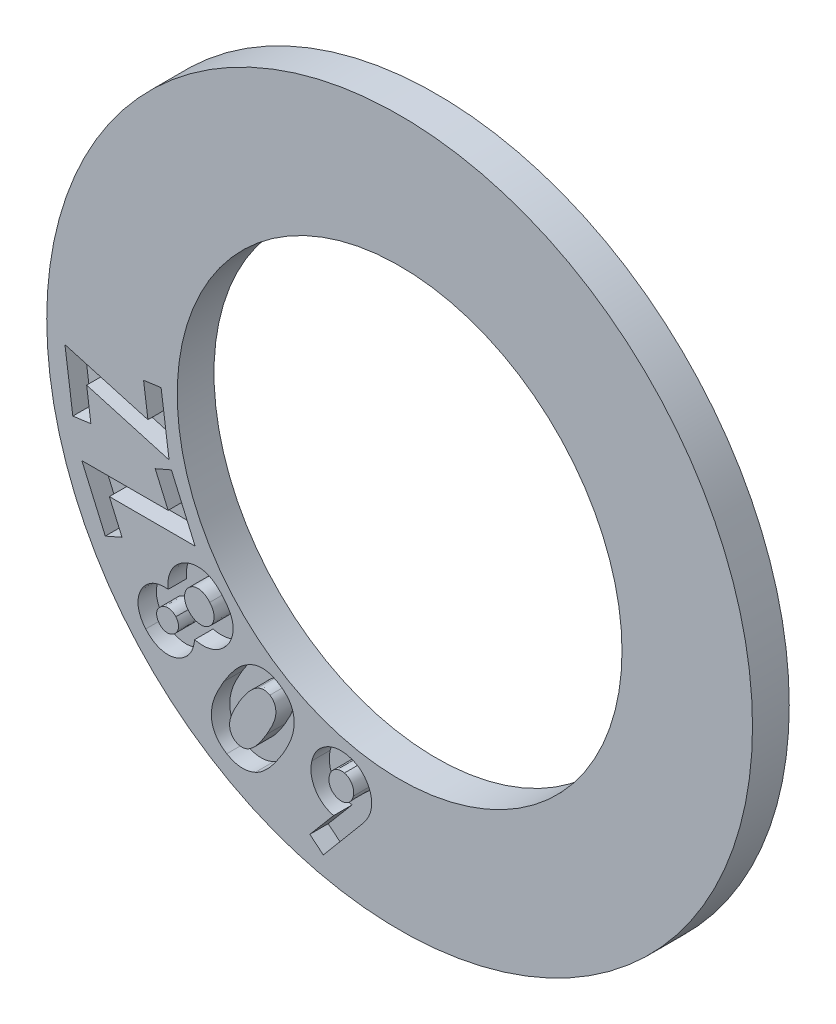
from build123d import *

# Parameters (mm, degrees)
SKETCH1_R           = 9.6
SKETCH1_R_2         = 6.05
BOSS_EXTRUDE1_DEPTH = 1
CUT_EXTRUDE1_DEPTH  = 0.5


with BuildPart() as part:
    # Sketch1 → Boss-Extrude1 (new body)
    with BuildSketch(Plane.XY):
        Circle(SKETCH1_R)
        Circle(SKETCH1_R_2, mode=Mode.SUBTRACT)
    extrude(amount=BOSS_EXTRUDE1_DEPTH)

    # Sketch2 → Cut-Extrude1 (cut)
    # profile 1 of 5: a face of its own
    with BuildSketch(Plane(origin=(0, 0, 1), x_dir=(-1, 0, 0), z_dir=(0, 0, -1))):
        Polygon((8.890156054, -1.935451646), (9.104252132, -0.357834674), (6.847018848, -0.999481884), (6.965203438, -0.129051987), (6.488667132, -0.064249467), (6.271844521, -1.65761186), (8.514239395, -1.017891134), (8.398753682, -1.868717145), align=None)
    # profile 2 of 5: a face of its own
    with BuildSketch(Plane(origin=(0, 0, 1), x_dir=(-1, 0, 0), z_dir=(0, 0, -1))):
        Polygon((8.006176083, -4.320560547), (8.644559969, -2.861239402), (6.297121805, -2.859725528), (6.649059911, -2.054636864), (6.208358864, -1.861621186), (5.563761336, -3.336078487), (7.896306962, -3.334763714), (7.552196812, -4.121778432), align=None)
    # profile 3 of 5: a face of its own
    with BuildSketch(Plane(origin=(0, 0, 1), x_dir=(-1, 0, 0), z_dir=(0, 0, -1))):
        with BuildLine():
            add(Edge.make_bspline(
                [(6.292450839, -4.71685014), (6.296231193, -4.682176947), (6.303695055, -4.613718822), (6.299500805, -4.510870124), (6.282570908, -4.410384792), (6.252624945, -4.313037783), (6.210396449, -4.220791991), (6.157710542, -4.134308751), (6.093891309, -4.054693471), (6.043852901, -4.008205609), (6.018613119, -3.984756751)],
                knots=[0, 0, 0, 0, 1.024853837, 2.023452895, 3.016288006, 4.01514397, 5.010261526, 5.9929112, 6.987607984, 8, 8, 8, 8], degree=3))
            add(Edge.make_bspline(
                [(6.018613119, -3.984756751), (5.989449767, -3.96133002), (5.931785214, -3.915008459), (5.835151695, -3.860987935), (5.732875157, -3.820460949), (5.625912679, -3.793530031), (5.517201798, -3.781285064), (5.409617772, -3.784153092), (5.304570685, -3.801470103), (5.219964587, -3.82967156), (5.153721518, -3.859262004), (5.104035215, -3.886570632), (5.05466803, -3.918917285), (5.004977701, -3.954783044), (4.956144384, -3.995875502), (4.906909349, -4.04052485), (4.857910449, -4.090167931), (4.826505161, -4.125885519), (4.810431036, -4.144166802)],
                knots=[0, 0, 0, 0, 1.305368651, 2.581099024, 3.850764689, 5.140623808, 6.423980154, 7.661476375, 8.890318023, 10.130629344, 10.765814822, 11.424103313, 12.109287923, 12.827286802, 13.564226721, 14.338200307, 15.149443372, 16, 16, 16, 16], degree=3))
            add(Edge.make_bspline(
                [(4.810431036, -4.144166802), (4.793521732, -4.163962083), (4.760541974, -4.202570626), (4.716083255, -4.261783345), (4.675779028, -4.319263734), (4.641071981, -4.375852092), (4.610055429, -4.430730905), (4.584845547, -4.484850577), (4.56469637, -4.537854511), (4.544080728, -4.606284927), (4.529116978, -4.692371852), (4.525897362, -4.796777852), (4.539194226, -4.901863225), (4.567030692, -5.00642441), (4.609410348, -5.108118487), (4.665566501, -5.204663165), (4.736800609, -5.293833946), (4.793074304, -5.346039497), (4.821752819, -5.372644781)],
                knots=[0, 0, 0, 0, 0.896755792, 1.749024705, 2.550016539, 3.314585236, 4.035324707, 4.720755999, 5.369330125, 5.987484303, 7.180911662, 8.36780135, 9.573414341, 10.816984, 12.085144379, 13.357898105, 14.653517282, 16, 16, 16, 16], degree=3))
            add(Edge.make_bspline(
                [(4.821752819, -5.372644781), (4.84827292, -5.394154083), (4.900365273, -5.436403929), (4.986017847, -5.487356661), (5.075309221, -5.526581845), (5.168569237, -5.553712707), (5.265540433, -5.569585114), (5.366499219, -5.573878496), (5.471481355, -5.566483537), (5.541707694, -5.552853565), (5.577644402, -5.545878741)],
                knots=[0, 0, 0, 0, 1.015115964, 1.993950896, 2.955318204, 3.910439945, 4.876497123, 5.872576642, 6.91134021, 8, 8, 8, 8], degree=3))
            add(Edge.make_bspline(
                [(5.577644402, -5.545878741), (5.580484821, -5.57331704), (5.586042257, -5.627001569), (5.602578712, -5.704928), (5.625289884, -5.778455797), (5.653676969, -5.848097739), (5.688567781, -5.913356571), (5.729814822, -5.974219876), (5.777994102, -6.030122423), (5.814206137, -6.063566), (5.832440685, -6.080406493)],
                knots=[0, 0, 0, 0, 1.088464957, 2.129641125, 3.13880773, 4.12337705, 5.094137209, 6.054973659, 7.020583194, 8, 8, 8, 8], degree=3))
            add(Edge.make_bspline(
                [(5.832440685, -6.080406493), (5.858665818, -6.101709414), (5.910224428, -6.143590956), (5.996641344, -6.192165189), (6.087035961, -6.22931833), (6.181811268, -6.252399652), (6.278094963, -6.263746053), (6.374950486, -6.260788022), (6.471110637, -6.24375008), (6.565922949, -6.212761042), (6.658253372, -6.1691234), (6.746534075, -6.111932026), (6.830596994, -6.042033888), (6.880739865, -5.987160124), (6.906414341, -5.959063305)],
                knots=[0, 0, 0, 0, 1.002422803, 1.97076321, 2.933279648, 3.898469767, 4.859911783, 5.806096433, 6.76719438, 7.751974939, 8.761712295, 9.79318899, 10.870054379, 12, 12, 12, 12], degree=3))
            add(Edge.make_bspline(
                [(6.906414341, -5.959063305), (6.930091547, -5.92995382), (6.976201186, -5.873265211), (7.03165128, -5.78095692), (7.073902846, -5.686403705), (7.102885757, -5.589810237), (7.117484265, -5.491987108), (7.118855172, -5.394271522), (7.105995939, -5.296932667), (7.079327362, -5.20165659), (7.040880325, -5.110227547), (6.990961989, -5.025267159), (6.930708481, -4.947258172), (6.88254917, -4.902640549), (6.858279071, -4.8801553)],
                knots=[0, 0, 0, 0, 1.117037858, 2.175350161, 3.197735414, 4.196422681, 5.170679331, 6.135746091, 7.099318227, 8.086013301, 9.075625523, 10.046419393, 11.015484382, 12, 12, 12, 12], degree=3))
            add(Edge.make_bspline(
                [(6.858279071, -4.8801553), (6.840406243, -4.865452673), (6.805097485, -4.836406821), (6.747192554, -4.800652805), (6.68754033, -4.770561757), (6.624039757, -4.746759924), (6.554057879, -4.730157101), (6.475508354, -4.719451316), (6.387142401, -4.715232318), (6.325105968, -4.716292221), (6.292450839, -4.71685014)],
                knots=[0, 0, 0, 0, 0.9170639, 1.811710394, 2.692387335, 3.564321737, 4.494782677, 5.539233306, 6.704686117, 8, 8, 8, 8], degree=3))
        make_face()
        with BuildLine():
            add(Edge.make_bspline(
                [(6.528704439, -5.654884461), (6.514953656, -5.669113344), (6.488277314, -5.696717194), (6.441148505, -5.728765106), (6.38896261, -5.748062241), (6.334115668, -5.757314463), (6.277931544, -5.755603918), (6.223128002, -5.741699743), (6.170374192, -5.716716442), (6.139515683, -5.692163431), (6.123537132, -5.67944987)],
                knots=[0, 0, 0, 0, 1.043190885, 2.023776935, 2.978919233, 3.958573061, 4.944778054, 5.923543227, 6.924809667, 8, 8, 8, 8], degree=3))
            add(Edge.make_bspline(
                [(6.123537132, -5.67944987), (6.108638416, -5.665300977), (6.079666339, -5.637787007), (6.046636074, -5.588359409), (6.024823834, -5.534086591), (6.015305285, -5.476367407), (6.015003434, -5.418131181), (6.027987455, -5.361935246), (6.051225953, -5.308569628), (6.075255605, -5.277765574), (6.087517856, -5.262046367)],
                knots=[0, 0, 0, 0, 1.053140134, 2.04793867, 3.027714218, 4.035678567, 5.037081648, 5.99967612, 6.979241393, 8, 8, 8, 8], degree=3))
            add(Edge.make_bspline(
                [(6.087517856, -5.262046367), (6.101510342, -5.247338222), (6.128829254, -5.218622056), (6.177937638, -5.186368361), (6.231546554, -5.165790901), (6.288266006, -5.157064195), (6.345984758, -5.159584898), (6.402728349, -5.174663066), (6.457698751, -5.201012922), (6.490243559, -5.226862284), (6.507015182, -5.24018348)],
                knots=[0, 0, 0, 0, 1.031988442, 2.014852999, 2.965050342, 3.937467417, 4.919217919, 5.887457926, 6.911323764, 8, 8, 8, 8], degree=3))
            add(Edge.make_bspline(
                [(6.507015182, -5.24018348), (6.521703742, -5.25418743), (6.550265559, -5.281418026), (6.582549218, -5.329906797), (6.60285203, -5.38265022), (6.612371975, -5.438223329), (6.609211442, -5.495220895), (6.594682857, -5.55145763), (6.567502624, -5.605709232), (6.541960422, -5.638083005), (6.528704439, -5.654884461)],
                knots=[0, 0, 0, 0, 1.041899463, 2.025967194, 2.967555479, 3.931260986, 4.904606775, 5.882145574, 6.900868324, 8, 8, 8, 8], degree=3))
        make_face(mode=Mode.SUBTRACT)
        with BuildLine():
            add(Edge.make_bspline(
                [(5.740044344, -4.948573334), (5.720070805, -4.969954484), (5.681227048, -5.01153571), (5.611768457, -5.059093508), (5.536951685, -5.09230451), (5.470711432, -5.106783356), (5.417253435, -5.110951474), (5.37824682, -5.111242186), (5.340744562, -5.106725334), (5.304771761, -5.099591733), (5.270426688, -5.087597677), (5.237734159, -5.072230809), (5.206484037, -5.052906165), (5.187396206, -5.03747111), (5.177673068, -5.029608658)],
                knots=[0, 0, 0, 0, 1.66515302, 3.238324511, 4.764125594, 6.31023234, 7.077911842, 7.822004061, 8.530999363, 9.229383497, 9.910087882, 10.600572151, 11.287146386, 12, 12, 12, 12], degree=3))
            add(Edge.make_bspline(
                [(5.177673068, -5.029608658), (5.167946182, -5.020854263), (5.148705975, -5.003537687), (5.123507828, -4.974562572), (5.102428651, -4.94350241), (5.083766112, -4.911357201), (5.069815746, -4.876784002), (5.059043936, -4.840702968), (5.051909497, -4.802982521), (5.048367479, -4.764058805), (5.048153995, -4.724514282), (5.052776713, -4.685142855), (5.060872626, -4.646134239), (5.073567926, -4.607634822), (5.090685024, -4.569775206), (5.11136589, -4.532373576), (5.136347733, -4.495616779), (5.155441251, -4.472297757), (5.16526343, -4.460301873)],
                knots=[0, 0, 0, 0, 0.984890082, 1.948155553, 2.882314859, 3.808863779, 4.741411075, 5.682178967, 6.640931769, 7.626899608, 8.622248044, 9.612961953, 10.606441355, 11.617930914, 12.658745083, 13.731137954, 14.832841024, 16, 16, 16, 16], degree=3))
            add(Edge.make_bspline(
                [(5.16526343, -4.460301873), (5.186008103, -4.4379681), (5.225880297, -4.395041585), (5.294998532, -4.345183994), (5.367568788, -4.310934135), (5.43065478, -4.296395612), (5.480923804, -4.292160189), (5.517871217, -4.294148538), (5.554170098, -4.298486238), (5.589266671, -4.308241531), (5.623798272, -4.320627974), (5.656661719, -4.338129604), (5.689259332, -4.358599804), (5.709373765, -4.375148464), (5.719711028, -4.383653197)],
                knots=[0, 0, 0, 0, 1.740634603, 3.345577987, 4.842409113, 6.303033479, 7.022492209, 7.722297156, 8.41653172, 9.109366691, 9.801537708, 10.511273576, 11.234909684, 12, 12, 12, 12], degree=3))
            add(Edge.make_bspline(
                [(5.719711028, -4.383653197), (5.729681879, -4.39251888), (5.749334636, -4.409993329), (5.774448754, -4.439862631), (5.796355416, -4.471011779), (5.814827057, -4.503747205), (5.82894589, -4.538405481), (5.839763209, -4.574674413), (5.846844683, -4.612744006), (5.850773242, -4.652225956), (5.849925937, -4.692065526), (5.846568376, -4.731565139), (5.837700947, -4.769884361), (5.82653983, -4.80781393), (5.810145714, -4.844353696), (5.790599185, -4.880235962), (5.767501488, -4.91543114), (5.74930062, -4.93740053), (5.740044344, -4.948573334)],
                knots=[0, 0, 0, 0, 1.013199327, 1.997037395, 2.95814882, 3.906124139, 4.8476064, 5.797388022, 6.778747326, 7.787574587, 8.807783302, 9.804646872, 10.795064647, 11.792380577, 12.806113963, 13.832317734, 14.897598492, 16, 16, 16, 16], degree=3))
        make_face(mode=Mode.SUBTRACT)
    # profile 4 of 5: a face of its own
    with BuildSketch(Plane(origin=(0, 0, 1), x_dir=(-1, 0, 0), z_dir=(0, 0, -1))):
        with BuildLine():
            add(Edge.make_bspline(
                [(4.700728427, -7.795616742), (4.720638572, -7.783132272), (4.759771347, -7.758594433), (4.814470153, -7.717412313), (4.864783206, -7.674033873), (4.911525287, -7.628615178), (4.953089061, -7.580121214), (4.990332788, -7.529021594), (5.023192318, -7.475643947), (5.052307077, -7.420027909), (5.075721636, -7.361605919), (5.09438204, -7.300769393), (5.108837783, -7.237649153), (5.117037831, -7.171861113), (5.122292406, -7.103935486), (5.120061159, -7.03350088), (5.115322827, -6.960556113), (5.104257609, -6.884763911), (5.087761363, -6.805773677), (5.064315426, -6.722859126), (5.033804865, -6.635967285), (4.997996979, -6.544058453), (4.953618583, -6.448781817), (4.904050752, -6.348644833), (4.847445386, -6.244464118), (4.80596073, -6.174526152), (4.784625576, -6.138557739)],
                knots=[0, 0, 0, 0, 0.898244672, 1.765472124, 2.614727858, 3.437232938, 4.254952735, 5.053616086, 5.852565071, 6.649712848, 7.450943246, 8.255158175, 9.081068285, 9.923120061, 10.788029142, 11.682991033, 12.614578547, 13.582065778, 14.608729996, 15.698190307, 16.873875029, 18.129006478, 19.468011642, 20.890949559, 22.401045719, 24, 24, 24, 24], degree=3))
            add(Edge.make_bspline(
                [(4.784625576, -6.138557739), (4.762727322, -6.102465829), (4.720119225, -6.032240707), (4.652841848, -5.933253224), (4.587662436, -5.841265745), (4.522388818, -5.7580152), (4.458981279, -5.681672652), (4.394778634, -5.61469299), (4.332245522, -5.554650767), (4.269546607, -5.502929045), (4.207279173, -5.45808791), (4.145461656, -5.419001916), (4.084621454, -5.384417752), (4.02329979, -5.356953344), (3.963161648, -5.332807942), (3.902752166, -5.315711695), (3.842918751, -5.303161926), (3.783299336, -5.296359015), (3.723512487, -5.295196556), (3.66339586, -5.298833071), (3.602630182, -5.307685857), (3.541575369, -5.322483631), (3.480026857, -5.342273676), (3.418196877, -5.367631761), (3.355317386, -5.397304502), (3.31447702, -5.421146208), (3.293602704, -5.433332174)],
                knots=[0, 0, 0, 0, 1.621896698, 3.155773551, 4.59789298, 5.953069552, 7.220030192, 8.409367974, 9.516274512, 10.549465595, 11.529711948, 12.462769859, 13.359122053, 14.215829103, 15.04275324, 15.846931649, 16.624656061, 17.389894974, 18.1489052, 18.919665042, 19.701791843, 20.50519619, 21.330921178, 22.183638005, 23.071621582, 24, 24, 24, 24], degree=3))
            add(Edge.make_bspline(
                [(3.293602704, -5.433332174), (3.27314021, -5.446130931), (3.233042204, -5.471211191), (3.176956879, -5.512848598), (3.125200633, -5.556071252), (3.078120873, -5.601703467), (3.036034509, -5.649641441), (2.998676876, -5.699670076), (2.966410245, -5.752013109), (2.938189331, -5.806269788), (2.914892485, -5.86296653), (2.8964833, -5.922169481), (2.882544486, -5.983605113), (2.873667331, -6.047736577), (2.869269786, -6.114019568), (2.86899656, -6.182799587), (2.874568071, -6.253723252), (2.88362701, -6.327664531), (2.898922501, -6.404987596), (2.921299366, -6.48625663), (2.949718077, -6.57216816), (2.985898136, -6.662414117), (3.02857333, -6.757326057), (3.078491547, -6.856553019), (3.134315936, -6.960696163), (3.17581114, -7.030463309), (3.197190336, -7.066408801)],
                knots=[0, 0, 0, 0, 0.933511523, 1.829295625, 2.700084285, 3.540981242, 4.363336638, 5.16576242, 5.95376278, 6.739893059, 7.529581581, 8.321957783, 9.136118686, 9.964249438, 10.824184875, 11.70479156, 12.62283328, 13.574831975, 14.585816176, 15.669219298, 16.834352981, 18.085147476, 19.429288662, 20.859624376, 22.382012829, 24, 24, 24, 24], degree=3))
            add(Edge.make_bspline(
                [(3.197190336, -7.066408801), (3.227521409, -7.115790646), (3.286145503, -7.211236197), (3.379508936, -7.343863115), (3.470734731, -7.463449574), (3.561917821, -7.568707565), (3.653489188, -7.658961496), (3.743760065, -7.736187022), (3.833981775, -7.799437674), (3.896876706, -7.831198338), (3.927187721, -7.846504786)],
                knots=[0, 0, 0, 0, 1.284191142, 2.482092967, 3.59302117, 4.616925941, 5.565842968, 6.439934982, 7.248156337, 8, 8, 8, 8], degree=3))
            add(Edge.make_bspline(
                [(3.927187721, -7.846504786), (3.959833229, -7.859853273), (4.023763131, -7.885993697), (4.122705669, -7.911422322), (4.220859884, -7.924245793), (4.318567478, -7.924223873), (4.41578037, -7.911548326), (4.512304869, -7.885748904), (4.608378293, -7.847490073), (4.66942776, -7.813198415), (4.700728427, -7.795616742)],
                knots=[0, 0, 0, 0, 1.04588366, 2.048160541, 3.022178198, 3.976877382, 4.940035928, 5.92349365, 6.9353546, 8, 8, 8, 8], degree=3))
        make_face()
        with BuildLine():
            add(Edge.make_bspline(
                [(4.466967208, -7.38342652), (4.448890208, -7.393193098), (4.413183596, -7.41248454), (4.354772228, -7.42928388), (4.294401622, -7.43614614), (4.242906327, -7.432170968), (4.200914994, -7.423650291), (4.168345129, -7.412987653), (4.135148967, -7.39833475), (4.101373041, -7.379895981), (4.067312802, -7.357305604), (4.032006124, -7.331819656), (3.996838211, -7.301367811), (3.960091155, -7.26769048), (3.922421853, -7.228999048), (3.883779817, -7.184542264), (3.843816188, -7.134075909), (3.800707034, -7.079226192), (3.758352063, -7.016807493), (3.712629697, -6.950106555), (3.665769298, -6.877211239), (3.634851609, -6.82624606), (3.618869002, -6.799900092)],
                knots=[0, 0, 0, 0, 1.073362255, 2.120159813, 3.159407462, 4.240635611, 4.808695944, 5.400373974, 6.031191226, 6.706632187, 7.412741198, 8.170311917, 8.985148812, 9.846903314, 10.780229985, 11.811125479, 12.929975119, 14.151240884, 15.462935153, 16.878452578, 18.386345578, 20, 20, 20, 20], degree=3))
            add(Edge.make_bspline(
                [(3.618869002, -6.799900092), (3.598573185, -6.765708357), (3.559566788, -6.699995487), (3.507591618, -6.602993389), (3.46363256, -6.512424232), (3.427957509, -6.42800269), (3.399874383, -6.350205195), (3.380355568, -6.278333427), (3.3679065, -6.212858126), (3.364985536, -6.152819332), (3.368657975, -6.098327532), (3.375734578, -6.047982592), (3.389486908, -6.00192671), (3.407247096, -5.959376387), (3.430784175, -5.920998119), (3.458643459, -5.885923435), (3.492280681, -5.855480725), (3.517703807, -5.838826579), (3.530539313, -5.830418313)],
                knots=[0, 0, 0, 0, 1.764642303, 3.3914544, 4.882955366, 6.231380764, 7.457798339, 8.550814255, 9.53429446, 10.409776827, 11.209959597, 11.956390011, 12.660733017, 13.33733554, 13.997190612, 14.652322853, 15.319591218, 16, 16, 16, 16], degree=3))
            add(Edge.make_bspline(
                [(3.530539313, -5.830418313), (3.543548509, -5.823214546), (3.568936617, -5.809156027), (3.609574553, -5.794761023), (3.650929524, -5.78626144), (3.693389203, -5.783895463), (3.736837693, -5.787611347), (3.781277725, -5.797199757), (3.826368534, -5.813319021), (3.855617051, -5.827961566), (3.870647544, -5.835486209)],
                knots=[0, 0, 0, 0, 0.997599185, 1.946865736, 2.882982674, 3.825398451, 4.793181853, 5.803966976, 6.871482658, 8, 8, 8, 8], degree=3))
            add(Edge.make_bspline(
                [(3.870647544, -5.835486209), (3.889815553, -5.846599485), (3.929966672, -5.869878402), (3.987107768, -5.915746086), (4.045971796, -5.970328754), (4.106245405, -6.034814404), (4.167607751, -6.109454037), (4.229946795, -6.194302238), (4.294110642, -6.288510748), (4.335451915, -6.355680363), (4.3568648, -6.390471147)],
                knots=[0, 0, 0, 0, 0.712445167, 1.492354806, 2.35190915, 3.296258774, 4.33146101, 5.46101176, 6.684920395, 8, 8, 8, 8], degree=3))
            add(Edge.make_bspline(
                [(4.3568648, -6.390471147), (4.377758813, -6.426067567), (4.41787646, -6.494414639), (4.472748121, -6.594397123), (4.51870216, -6.688059858), (4.556327766, -6.775135046), (4.586489077, -6.855404608), (4.607435764, -6.929333618), (4.620966111, -6.99659022), (4.625675287, -7.05784245), (4.623554444, -7.113625699), (4.615867183, -7.164726941), (4.604216218, -7.211910835), (4.586282903, -7.254523246), (4.564338567, -7.293381221), (4.536852037, -7.327896894), (4.504611824, -7.358745865), (4.479610929, -7.375137013), (4.466967208, -7.38342652)],
                knots=[0, 0, 0, 0, 1.792089233, 3.440909255, 4.9506621, 6.31996594, 7.558372941, 8.670644588, 9.652991284, 10.531963663, 11.331388748, 12.071336497, 12.772788479, 13.435328746, 14.072424132, 14.704326223, 15.344737917, 16, 16, 16, 16], degree=3))
        make_face(mode=Mode.SUBTRACT)
    # profile 5 of 5: a face of its own
    with BuildSketch(Plane(origin=(0, 0, 1), x_dir=(-1, 0, 0), z_dir=(0, 0, -1))):
        with BuildLine():
            Line((2.075975898, -8.867229502), (2.442037742, -8.564737894))
            Line((2.442037742, -8.564737894), (1.794478505, -7.798544074))
            add(Edge.make_bspline(
                [(1.794478505, -7.798544074), (1.820964617, -7.79179497), (1.873067153, -7.778518373), (1.947212391, -7.748786528), (2.017197131, -7.7137812), (2.08270224, -7.671966929), (2.142674771, -7.62271753), (2.19866903, -7.56776453), (2.248980162, -7.505552249), (2.294830283, -7.438128539), (2.334168318, -7.366324115), (2.365758356, -7.291692022), (2.389809342, -7.215368145), (2.405504367, -7.137094957), (2.413214049, -7.056855229), (2.412408568, -6.974657237), (2.404990885, -6.890498257), (2.393160628, -6.834639339), (2.387161775, -6.806314557)],
                knots=[0, 0, 0, 0, 1.017149872, 2.000900977, 2.968404557, 3.929192477, 4.888604541, 5.85424859, 6.84661301, 7.86369901, 8.888083039, 9.891018333, 10.87795613, 11.863840162, 12.85934195, 13.874829846, 14.922374753, 16, 16, 16, 16], degree=3))
            add(Edge.make_bspline(
                [(2.387161775, -6.806314557), (2.380192006, -6.77914442), (2.366473564, -6.725666041), (2.337273296, -6.64899094), (2.301124513, -6.577312958), (2.258432192, -6.510669761), (2.209874211, -6.448476891), (2.154059485, -6.39152331), (2.091415237, -6.339736705), (2.023339261, -6.292889797), (1.951339053, -6.252916884), (1.877201322, -6.220071063), (1.801586439, -6.195074715), (1.724551245, -6.178663361), (1.646197361, -6.169540412), (1.5665705, -6.169113773), (1.485435115, -6.175734798), (1.431760629, -6.186797037), (1.404618601, -6.192390972)],
                knots=[0, 0, 0, 0, 1.043482651, 2.053863824, 3.046975941, 4.026671748, 4.995357891, 5.979018667, 6.98862908, 8.016409947, 9.05081794, 10.049466992, 11.030750709, 12.009563231, 12.976461881, 13.961704177, 14.969277807, 16, 16, 16, 16], degree=3))
            add(Edge.make_bspline(
                [(1.404618601, -6.192390972), (1.376563169, -6.199545719), (1.321334913, -6.213630128), (1.242449318, -6.24407306), (1.168944519, -6.28119918), (1.100273379, -6.324280596), (1.037967382, -6.375338619), (0.980587411, -6.432265549), (0.928156195, -6.495785396), (0.882718775, -6.565757455), (0.842689307, -6.63876944), (0.810778608, -6.713525595), (0.785926014, -6.78855468), (0.768880184, -6.864270238), (0.760180961, -6.940639218), (0.759052812, -7.01745304), (0.76503761, -7.094798126), (0.775497423, -7.145800118), (0.780772208, -7.171519941)],
                knots=[0, 0, 0, 0, 1.076771462, 2.119668351, 3.138855414, 4.137930249, 5.129948999, 6.130040132, 7.14214048, 8.188554738, 9.230311112, 10.237272993, 11.209039839, 12.16808984, 13.120150363, 14.064025428, 15.023706265, 16, 16, 16, 16], degree=3))
            add(Edge.make_bspline(
                [(0.780772208, -7.171519941), (0.785695075, -7.191266775), (0.795566926, -7.230865209), (0.816684362, -7.288885259), (0.841553823, -7.346284436), (0.866665251, -7.393732867), (0.890667918, -7.432879936), (0.911992965, -7.465983752), (0.937591986, -7.502234227), (0.966962321, -7.54172392), (0.999782204, -7.584942106), (1.036636897, -7.631227095), (1.077395048, -7.680940574), (1.106233971, -7.71491697), (1.121207521, -7.732557964)],
                knots=[0, 0, 0, 0, 1.104048863, 2.213955231, 3.346623497, 4.498096029, 5.124114234, 5.839024271, 6.635248401, 7.532490536, 8.510510828, 9.580890686, 10.743966451, 12, 12, 12, 12], degree=3))
            Line((1.121207521, -7.732557964), (2.075975898, -8.867229502))
        make_face()
        with BuildLine():
            add(Edge.make_bspline(
                [(1.659476858, -7.344258013), (1.637398016, -7.348178216), (1.594123199, -7.355861864), (1.528587008, -7.350615517), (1.465854129, -7.332444684), (1.40766774, -7.300415508), (1.355426899, -7.257773565), (1.312424441, -7.204802184), (1.278869212, -7.143153769), (1.266287616, -7.097452272), (1.259823616, -7.073972381)],
                knots=[0, 0, 0, 0, 0.996814877, 1.953770138, 2.902120449, 3.890583161, 4.89561901, 5.891498935, 6.916723156, 8, 8, 8, 8], degree=3))
            add(Edge.make_bspline(
                [(1.259823616, -7.073972381), (1.255616103, -7.049928845), (1.247421663, -7.003102287), (1.250195961, -6.932155229), (1.267606693, -6.864588265), (1.297889604, -6.802066786), (1.336866966, -6.746324165), (1.384713086, -6.7010004), (1.43999171, -6.667469749), (1.480865077, -6.655442176), (1.50143053, -6.649390497)],
                knots=[0, 0, 0, 0, 1.079698362, 2.102792092, 3.119512468, 4.150487749, 5.166695323, 6.117818656, 7.052979628, 8, 8, 8, 8], degree=3))
            add(Edge.make_bspline(
                [(1.50143053, -6.649390497), (1.523510207, -6.645451061), (1.567025374, -6.637687126), (1.633434453, -6.643375638), (1.697704716, -6.661954015), (1.758536441, -6.69327309), (1.813280003, -6.735883842), (1.85784641, -6.789675388), (1.892551949, -6.852425754), (1.905529723, -6.899127896), (1.912191673, -6.923101756)],
                knots=[0, 0, 0, 0, 0.976201659, 1.923922042, 2.88018245, 3.883464177, 4.89481687, 5.88873447, 6.916212802, 8, 8, 8, 8], degree=3))
            add(Edge.make_bspline(
                [(1.912191673, -6.923101756), (1.916661267, -6.947069107), (1.925347059, -6.993645032), (1.921650589, -7.063815135), (1.906139154, -7.130626411), (1.87604538, -7.192032803), (1.836005101, -7.246841219), (1.785370097, -7.29107821), (1.726297756, -7.325370563), (1.682203464, -7.33783416), (1.659476858, -7.344258013)],
                knots=[0, 0, 0, 0, 1.063720745, 2.067136068, 3.050235713, 4.046505155, 5.039046841, 6.001370969, 6.969888122, 8, 8, 8, 8], degree=3))
        make_face(mode=Mode.SUBTRACT)
    extrude(amount=CUT_EXTRUDE1_DEPTH, mode=Mode.SUBTRACT)


solid = part.part
